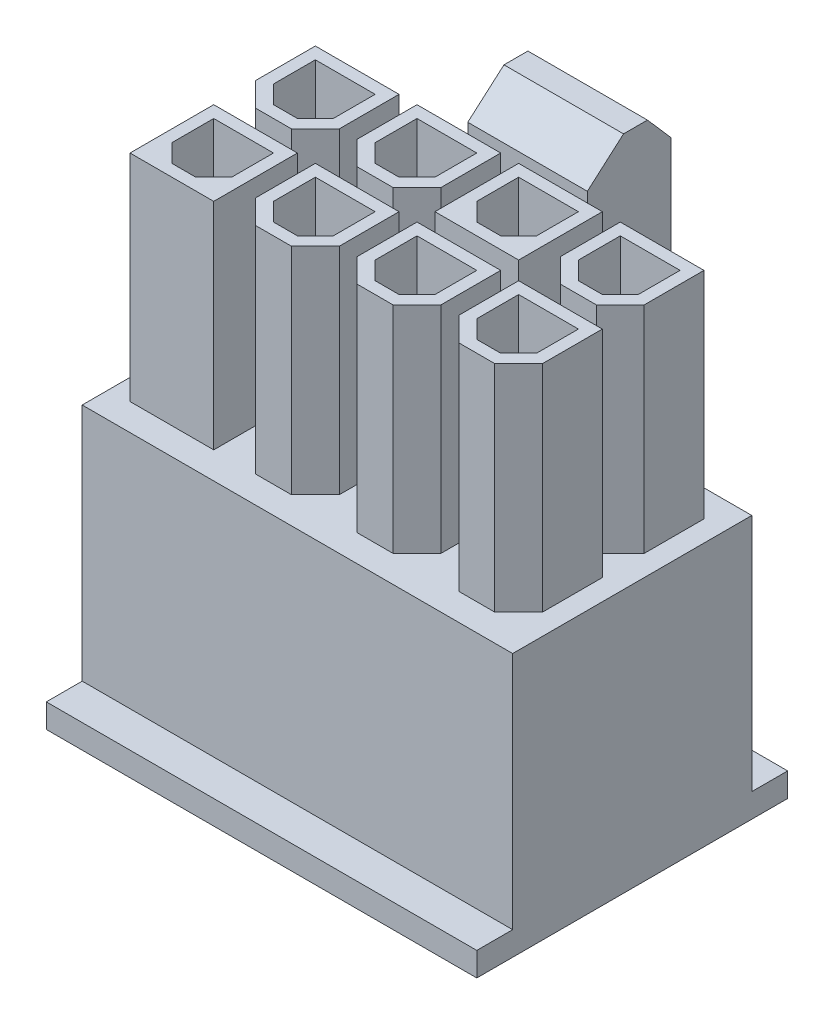
from build123d import *

# Parameters (mm, degrees)
SKIZZE1_W                       = 10
SKIZZE1_H                       = 11
AUFSATZ_LINEAR_AUSTRAGEN1_DEPTH = 9
SKIZZE2_W                       = 1.5
SKIZZE2_H                       = 1
AUFSATZ_LINEAR_AUSTRAGEN2_DEPTH = 9
AUFSATZ_LINEAR_AUSTRAGEN3_DEPTH = 4
SKIZZE4_W                       = 5
SKIZZE4_H                       = 1.5
SCHNITT_LINEAR_AUSTRAGEN1_DEPTH = 17.560495162
AUFSATZ_LINEAR_AUSTRAGEN4_DEPTH = 2.5
SKIZZE6_W                       = 3.75
SKIZZE6_H                       = 3.75
SCHNITT_LINEAR_AUSTRAGEN2_DEPTH = 10
LINEARES_MUSTER1_COUNT          = 4
LINEARES_MUSTER1_PITCH          = 4.25
LINEARES_MUSTER1_COUNT_DIR2     = 2
LINEARES_MUSTER1_PITCH_DIR2     = 4.25
SKIZZE7_W                       = 3.5
SKIZZE7_H                       = 3.5
AUFSATZ_LINEAR_AUSTRAGEN5_DEPTH = 9
LINEARES_MUSTER2_COUNT          = 3
LINEARES_MUSTER2_PITCH          = 4.25
LINEARES_MUSTER2_COUNT_DIR2     = 2
LINEARES_MUSTER2_PITCH_DIR2     = 4.25
AUFSATZ_LINEAR_AUSTRAGEN7_DEPTH = 9
LINEARES_MUSTER4_COUNT          = 4
LINEARES_MUSTER4_PITCH          = 4.25
LINEARES_MUSTER4_COUNT_DIR2     = 2
LINEARES_MUSTER4_PITCH_DIR2     = 4.25
SCHNITT_LINEAR_AUSTRAGEN4_DEPTH = 24.521266973
LINEARES_MUSTER6_COUNT          = 4
LINEARES_MUSTER6_PITCH          = 4.25
LINEARES_MUSTER6_COUNT_DIR2     = 2
LINEARES_MUSTER6_PITCH_DIR2     = 4.25


with BuildPart() as part:
    # Skizze1 → Aufsatz-Linear austragen1 (new, symmetric)
    with BuildSketch(Plane(origin=(0, 0, 0), x_dir=(0, 0, -1), z_dir=(1, 0, 0))):
        with Locations((0, 5.5)):
            Rectangle(SKIZZE1_W, SKIZZE1_H)
    extrude(amount=AUFSATZ_LINEAR_AUSTRAGEN1_DEPTH, both=True)

    # Skizze2 → Aufsatz-Linear austragen2 (add, symmetric)
    with BuildSketch(Plane(origin=(0, 0, 0), x_dir=(0, 0, -1), z_dir=(1, 0, 0))):
        with Locations((-5.75, 0.5)):
            Rectangle(SKIZZE2_W, SKIZZE2_H)
        with Locations((5.75, 0.5)):
            Rectangle(SKIZZE2_W, SKIZZE2_H)
    extrude(amount=AUFSATZ_LINEAR_AUSTRAGEN2_DEPTH, both=True)

    # Skizze3 → Aufsatz-Linear austragen3 (add, symmetric)
    with BuildSketch(Plane(origin=(0, 0, 0), x_dir=(0, 0, -1), z_dir=(1, 0, 0))):
        with BuildLine():
            Line((5, 11), (5.571713615, 11))
            ThreePointArc((5.571713615, 11), (5.836038655, 10.149642784), (6.535856807, 9.598979842))
            ThreePointArc((6.535856807, 9.598979842), (7.23567496, 9.048316901), (7.5, 8.197959685))
            Line((7.5, 8.197959685), (7.5, 5.197959685))
            Line((7.5, 5.197959685), (8.5, 4))
            Line((8.5, 4), (8.5, 2))
            Line((8.5, 2), (6.5, 2))
            Line((6.5, 2), (6.5, 8))
            Line((6.5, 8), (5, 8))
            Line((5, 8), (5, 11))
        make_face()
    extrude(amount=AUFSATZ_LINEAR_AUSTRAGEN3_DEPTH, both=True)

    # Skizze4 → Schnitt-Linear austragen1 (cut, through all)
    with BuildSketch(Plane.XZ):
        with Locations((0, -5.75)):
            Rectangle(SKIZZE4_W, SKIZZE4_H)
    extrude(amount=-SCHNITT_LINEAR_AUSTRAGEN1_DEPTH, mode=Mode.SUBTRACT)

    # Skizze5 → Aufsatz-Linear austragen4 (add, symmetric)
    with BuildSketch(Plane(origin=(0, 0, 0), x_dir=(0, 0, -1), z_dir=(1, 0, 0))):
        Polygon((8.123516438, 4.451012129), (8.123516438, 19.870653012), (7.136310593, 21), (6.136310593, 21), (4.623516438, 19.677608169), (4.623516438, 17.677608169), (6.123516438, 17.677608169), (6.5, 8), (6.5, 2), align=None)
    extrude(amount=AUFSATZ_LINEAR_AUSTRAGEN4_DEPTH, both=True)

    # Skizze6 → Schnitt-Linear austragen2 (cut)
    with BuildSketch(Plane.XZ):
        with Locations((-6.375, -2.125)):
            Rectangle(SKIZZE6_W, SKIZZE6_H)
    schnitt_linear_austragen2 = extrude(amount=-SCHNITT_LINEAR_AUSTRAGEN2_DEPTH, mode=Mode.SUBTRACT)

    # Lineares Muster1: Schnitt-Linear austragen2 4 × 2
    with Locations(*[(i * LINEARES_MUSTER1_PITCH, 0, j * LINEARES_MUSTER1_PITCH_DIR2) for i in range(LINEARES_MUSTER1_COUNT) for j in range(LINEARES_MUSTER1_COUNT_DIR2) if (i, j) != (0, 0)]):
        add(schnitt_linear_austragen2, mode=Mode.SUBTRACT)

    # Skizze7 → Aufsatz-Linear austragen5 (add)
    with BuildSketch(Plane(origin=(0, 11, 0), x_dir=(1, 0, 0), z_dir=(0, 1, 0))):
        with Locations((-6.375, -2.125)):
            Rectangle(SKIZZE7_W, SKIZZE7_H)
    aufsatz_linear_austragen5 = extrude(amount=AUFSATZ_LINEAR_AUSTRAGEN5_DEPTH)

    # Lineares Muster2: Aufsatz-Linear austragen5 3 × 2, 4 skipped
    with Locations(*[(i * LINEARES_MUSTER2_PITCH, 0, -j * LINEARES_MUSTER2_PITCH_DIR2) for i in range(LINEARES_MUSTER2_COUNT) for j in range(LINEARES_MUSTER2_COUNT_DIR2) if (i, j) not in ((0, 0), (0, 1), (1, 0), (1, 1), (2, 0))]):
        add(aufsatz_linear_austragen5)

    # Skizze10 → Aufsatz-Linear austragen7 (add)
    with BuildSketch(Plane(origin=(0, 11, 0), x_dir=(1, 0, 0), z_dir=(0, 1, 0))):
        Polygon((-4.625, 1.375), (-5.625, 0.375), (-7.125, 0.375), (-8.125, 1.375), (-8.125, 3.875), (-4.625, 3.875), align=None)
    aufsatz_linear_austragen7 = extrude(amount=AUFSATZ_LINEAR_AUSTRAGEN7_DEPTH)

    # Lineares Muster4: Aufsatz-Linear austragen7 4 × 2, 2 skipped
    with Locations(*[(i * LINEARES_MUSTER4_PITCH, 0, j * LINEARES_MUSTER4_PITCH_DIR2) for i in range(LINEARES_MUSTER4_COUNT) for j in range(LINEARES_MUSTER4_COUNT_DIR2) if (i, j) not in ((0, 0), (0, 1), (2, 0))]):
        add(aufsatz_linear_austragen7)

    # Skizze12 → Schnitt-Linear austragen4 (cut, through all)
    with BuildSketch(Plane(origin=(0, 20, 0), x_dir=(1, 0, 0), z_dir=(0, 1, 0))):
        Polygon((-5.875, 0.875), (-5.125, 1.625), (-5.125, 3.375), (-7.625, 3.375), (-7.625, 1.625), (-6.875, 0.875), align=None)
    schnitt_linear_austragen4 = extrude(amount=-SCHNITT_LINEAR_AUSTRAGEN4_DEPTH, mode=Mode.SUBTRACT)

    # Lineares Muster6: Schnitt-Linear austragen4 4 × 2
    with Locations(*[(i * LINEARES_MUSTER6_PITCH, 0, j * LINEARES_MUSTER6_PITCH_DIR2) for i in range(LINEARES_MUSTER6_COUNT) for j in range(LINEARES_MUSTER6_COUNT_DIR2) if (i, j) != (0, 0)]):
        add(schnitt_linear_austragen4, mode=Mode.SUBTRACT)


solid = part.part
